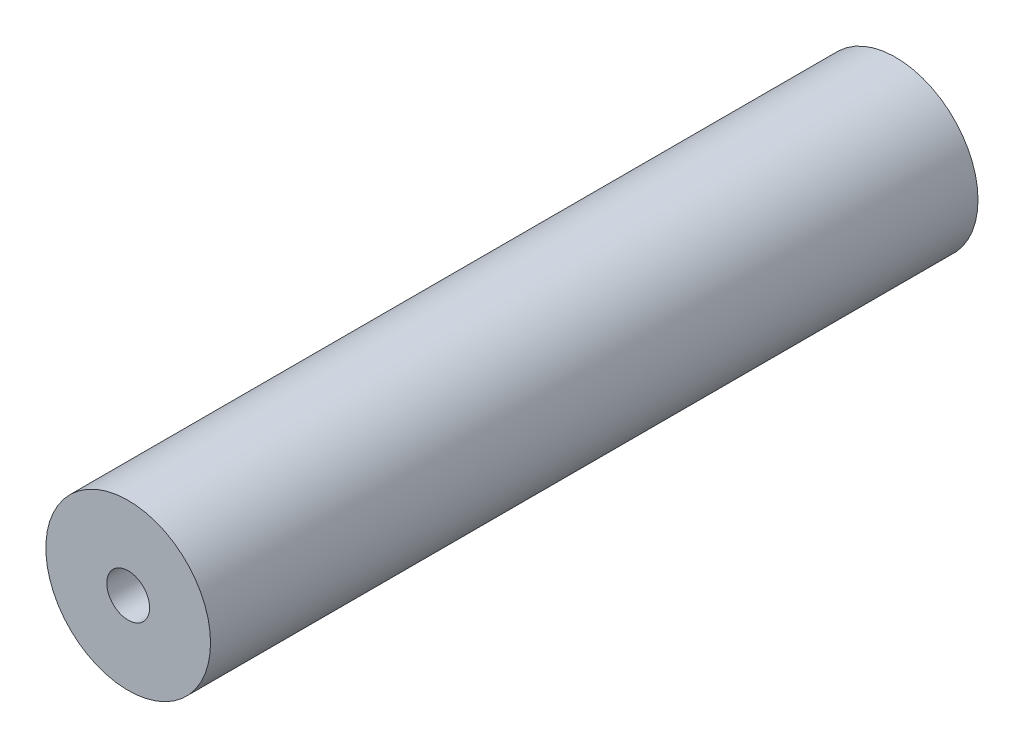
from build123d import *

# Parameters (mm, degrees)
SKETCH_1_R          = 5
EXTRUDE_1_DEPTH     = 46.6
SKETCH_2_R          = 1.3
CUT_EXTRUDE_1_DEPTH = 48.133427628


with BuildPart() as part:
    # ｽｹｯﾁ1 → ﾎﾞｽ - 押し出し1 (new body)
    with BuildSketch(Plane.XY):
        Circle(SKETCH_1_R)
    extrude(amount=EXTRUDE_1_DEPTH)

    # ｽｹｯﾁ2 → ｶｯﾄ - 押し出し1 (cut, through all)
    with BuildSketch(Plane.XY.offset(46.6)):
        Circle(SKETCH_2_R)
    extrude(amount=-CUT_EXTRUDE_1_DEPTH, mode=Mode.SUBTRACT)


solid = part.part
